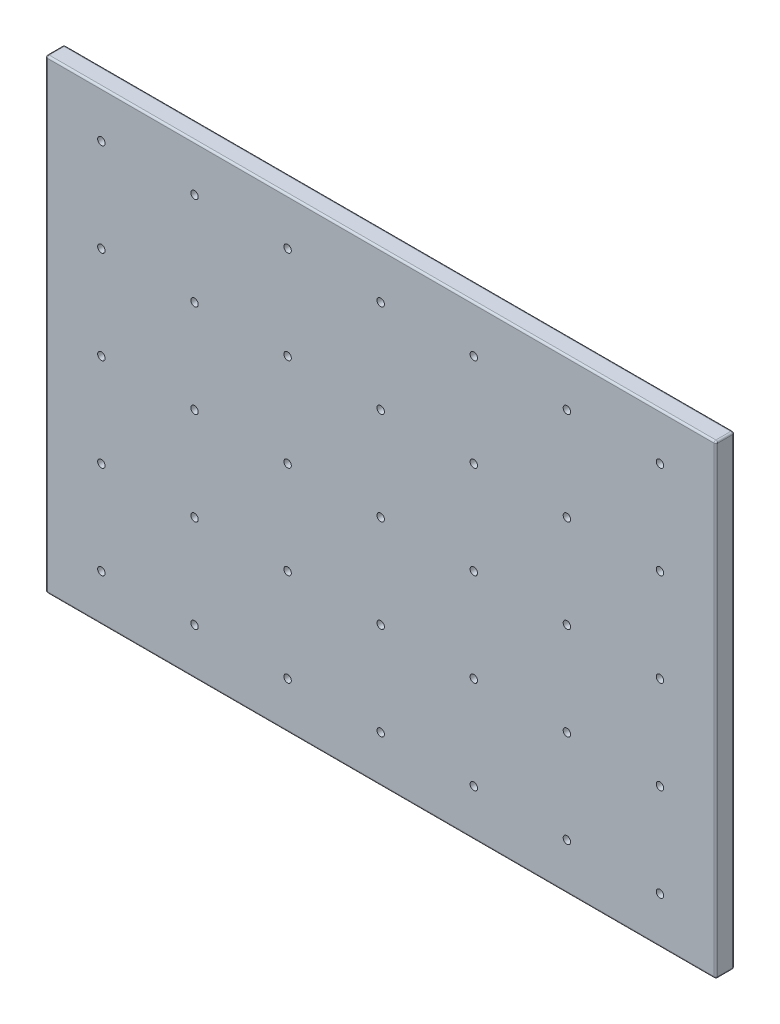
from build123d import *

# Parameters (mm, degrees)
SKETCH1_W           = 720
SKETCH1_H           = 500
BOSS_EXTRUDE1_DEPTH = 20
SKETCH2_R           = 4
CUT_EXTRUDE1_DEPTH  = 10
FILLET1_R           = 2


with BuildPart() as part:
    # Sketch1 → Boss-Extrude1 (new body)
    with BuildSketch(Plane.XY):
        Rectangle(SKETCH1_W, SKETCH1_H)
    extrude(amount=BOSS_EXTRUDE1_DEPTH)

    # Sketch2 → Cut-Extrude1 (cut)
    with BuildSketch(Plane.XY.offset(20)):
        with Locations((-300, 200)):
            Circle(SKETCH2_R)
        with Locations((-200, 200)):
            Circle(SKETCH2_R)
        with Locations((-100, 200)):
            Circle(SKETCH2_R)
        with Locations((0, 200)):
            Circle(SKETCH2_R)
        with Locations((100, 200)):
            Circle(SKETCH2_R)
        with Locations((200, 200)):
            Circle(SKETCH2_R)
        with Locations((300, 200)):
            Circle(SKETCH2_R)
        with Locations((-200, 100)):
            Circle(SKETCH2_R)
        with Locations((-100, 100)):
            Circle(SKETCH2_R)
        with Locations((0, 100)):
            Circle(SKETCH2_R)
        with Locations((100, 100)):
            Circle(SKETCH2_R)
        with Locations((200, 100)):
            Circle(SKETCH2_R)
        with Locations((300, 100)):
            Circle(SKETCH2_R)
        with Locations((-200, 0)):
            Circle(SKETCH2_R)
        with Locations((-100, 0)):
            Circle(SKETCH2_R)
        Circle(SKETCH2_R)
        with Locations((100, 0)):
            Circle(SKETCH2_R)
        with Locations((200, 0)):
            Circle(SKETCH2_R)
        with Locations((300, 0)):
            Circle(SKETCH2_R)
        with Locations((-200, -100)):
            Circle(SKETCH2_R)
        with Locations((-100, -100)):
            Circle(SKETCH2_R)
        with Locations((0, -100)):
            Circle(SKETCH2_R)
        with Locations((100, -100)):
            Circle(SKETCH2_R)
        with Locations((200, -100)):
            Circle(SKETCH2_R)
        with Locations((300, -100)):
            Circle(SKETCH2_R)
        with Locations((-200, -200)):
            Circle(SKETCH2_R)
        with Locations((-100, -200)):
            Circle(SKETCH2_R)
        with Locations((0, -200)):
            Circle(SKETCH2_R)
        with Locations((100, -200)):
            Circle(SKETCH2_R)
        with Locations((200, -200)):
            Circle(SKETCH2_R)
        with Locations((300, -200)):
            Circle(SKETCH2_R)
        with Locations((-300, 100)):
            Circle(SKETCH2_R)
        with Locations((-300, 0)):
            Circle(SKETCH2_R)
        with Locations((-300, -100)):
            Circle(SKETCH2_R)
        with Locations((-300, -200)):
            Circle(SKETCH2_R)
    extrude(amount=-CUT_EXTRUDE1_DEPTH, mode=Mode.SUBTRACT)

    # Fillet1
    fillet1_edges = [part.edges().sort_by_distance(p)[0] for p in [
        (360, 0, 20),
        (0, 250, 20),
        (-360, 0, 20),
        (0, 250, 0),
        (360, 0, 0),
        (0, -250, 0),
        (-360, 0, 0),
        (-360, 250, 10),
        (360, 250, 10),
        (360, -250, 10),
        (-360, -250, 10),
        (0, -250, 20),
    ]]
    fillet(fillet1_edges, radius=FILLET1_R)


solid = part.part
